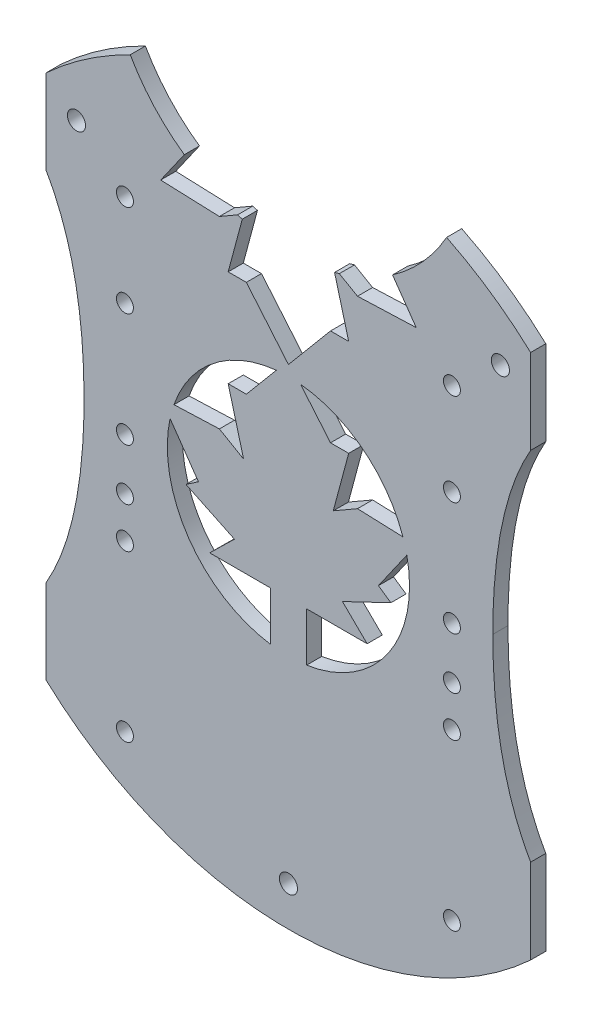
from build123d import *

# Parameters (mm, degrees)
SKETCH1_R           = 1.89865
BOSS_EXTRUDE3_DEPTH = 3.175
CUT_EXTRUDE2_DEPTH  = 3.175
SKETCH4_R           = 1.778
CUT_EXTRUDE3_DEPTH  = 3.175
SKETCH5_R           = 1.778
CUT_EXTRUDE4_DEPTH  = 3.175
CUT_EXTRUDE5_DEPTH  = 3.175
CUT_EXTRUDE6_DEPTH  = 3.175


with BuildPart() as part:
    # Sketch1 → Boss-Extrude3 (new body)
    with BuildSketch(Plane.XY):
        with BuildLine():
            Line((-50.8, 55.175719298), (-50.8, -55.175719298))
            ThreePointArc((-50.8, -55.175719298), (0, -75), (50.8, -55.175719298))
            Line((50.8, -55.175719298), (50.8, 55.175719298))
            ThreePointArc((50.8, 55.175719298), (42.419210034, 61.851520758), (33.172661219, 67.264957799))
            ThreePointArc((33.172661219, 67.264957799), (0, 47.904876359), (-33.172661219, 67.264957799))
            ThreePointArc((-33.172661219, 67.264957799), (-42.419210034, 61.851520758), (-50.8, 55.175719298))
        make_face()
        with Locations((0, -66.675)):
            Circle(SKETCH1_R, mode=Mode.SUBTRACT)
        with Locations((-44.45, 49.6966108)):
            Circle(SKETCH1_R, mode=Mode.SUBTRACT)
        with Locations(Location((44.45, 49.6966108, 0), (0, 0, 180))):
            Circle(SKETCH1_R, mode=Mode.SUBTRACT)
    extrude(amount=BOSS_EXTRUDE3_DEPTH)

    # Sketch3 → Cut-Extrude2 (cut)
    with BuildSketch(Plane.XY.offset(3.175)):
        with BuildLine():
            Line((8.827105782, 17.78), (2.54, 25.272680903))
            ThreePointArc((2.54, 25.272680903), (15.758317518, 19.920728626), (24.009298775, 8.289365013))
            Line((24.009298775, 8.289365013), (14.484298775, 8.647939367))
            Line((14.484298775, 8.647939367), (9.404298775, 5.715))
            Line((9.404298775, 5.715), (12.637105782, 17.78))
            Line((12.637105782, 17.78), (8.827105782, 17.78))
        make_face()
        with BuildLine():
            Line((18.868143133, -3.140634987), (24.826209076, 5.368365013))
            ThreePointArc((24.826209076, 5.368365013), (20.911260009, -14.418016674), (3.81, -25.112624315))
            Line((3.81, -25.112624315), (3.81, -14.877877919))
            Line((3.81, -14.877877919), (16.51, -14.877877919))
            Line((16.51, -14.877877919), (11.327081569, -9.797877919))
            Line((11.327081569, -9.797877919), (21.487081569, -4.935568543))
            Line((21.487081569, -4.935568543), (18.868143133, -3.140634987))
        make_face()
        with BuildLine():
            Line((-3.81, -14.877877919), (-3.81, -25.112624315))
            ThreePointArc((-3.81, -25.112624315), (-20.911260009, -14.418016674), (-24.826209076, 5.368365013))
            Line((-24.826209076, 5.368365013), (-18.868143133, -3.140634987))
            Line((-18.868143133, -3.140634987), (-21.487081569, -4.935568543))
            Line((-21.487081569, -4.935568543), (-11.327081569, -9.797877919))
            Line((-11.327081569, -9.797877919), (-16.51, -14.877877919))
            Line((-16.51, -14.877877919), (-3.81, -14.877877919))
        make_face()
        with BuildLine():
            Line((-14.484298775, 8.647939367), (-24.009298775, 8.289365013))
            ThreePointArc((-24.009298775, 8.289365013), (-15.758317518, 19.920728626), (-2.54, 25.272680903))
            Line((-2.54, 25.272680903), (-8.827105782, 17.78))
            Line((-8.827105782, 17.78), (-12.637105782, 17.78))
            Line((-12.637105782, 17.78), (-9.404298775, 5.715))
            Line((-9.404298775, 5.715), (-14.484298775, 8.647939367))
        make_face()
    extrude(amount=-CUT_EXTRUDE2_DEPTH, mode=Mode.SUBTRACT)

    # Sketch4 → Cut-Extrude3 (cut)
    with BuildSketch(Plane.XY.offset(3.175)):
        with Locations((-34.29, 40.919876359)):
            Circle(SKETCH4_R)
        with Locations((34.29, 40.919876359)):
            Circle(SKETCH4_R)
        with Locations((34.29, -2.260123641)):
            Circle(SKETCH4_R)
        with Locations((-34.29, -2.260123641)):
            Circle(SKETCH4_R)
        with Locations((-34.29, -13.055123641)):
            Circle(SKETCH4_R)
        with Locations((34.29, -13.055123641)):
            Circle(SKETCH4_R)
        with Locations((34.29, -56.235123641)):
            Circle(SKETCH4_R)
        with Locations((-34.29, -56.235123641)):
            Circle(SKETCH4_R)
    extrude(amount=-CUT_EXTRUDE3_DEPTH, mode=Mode.SUBTRACT)

    # Sketch5 → Cut-Extrude4 (cut)
    with BuildSketch(Plane.XY.offset(3.175)):
        with Locations((-34.29, 21.59)):
            Circle(SKETCH5_R)
        with Locations((34.29, 21.59)):
            Circle(SKETCH5_R)
        with Locations((34.29, -21.59)):
            Circle(SKETCH5_R)
        with Locations((-34.29, -21.59)):
            Circle(SKETCH5_R)
    extrude(amount=-CUT_EXTRUDE4_DEPTH, mode=Mode.SUBTRACT)

    # Sketch6 → Cut-Extrude5 (cut)
    with BuildSketch(Plane.XY.offset(3.175)):
        Polygon((-8.827105782, 38.1), (-2.54, 30.607319097), (0, 27.580264972), (2.54, 30.607319097), (8.827105782, 38.1), (12.637105782, 38.1), (9.404298775, 50.165), (14.484298775, 47.232060633), (24.009298775, 47.590634987), (26.798005722, 47.695617537), (24.826209076, 50.511634987), (18.868143133, 59.020634987), (-18.868143133, 59.020634987), (-24.826209076, 50.511634987), (-26.798005722, 47.695617537), (-24.009298775, 47.590634987), (-14.484298775, 47.232060633), (-9.404298775, 50.165), (-12.637105782, 38.1), align=None)
    extrude(amount=-CUT_EXTRUDE5_DEPTH, mode=Mode.SUBTRACT)

    # Sketch7 → Cut-Extrude6 (cut)
    with BuildSketch(Plane.XY.offset(3.175)):
        with BuildLine():
            Line((-50.8, 37.395719298), (-50.8, -37.395719298))
            add(Edge.make_bspline(
                [(-50.8, -37.395719298), (-42.8625, -23.647566012), (-42.8625, 0)],
                knots=[0, 0, 0, 1, 1, 1], degree=2))
            add(Edge.make_bspline(
                [(-50.8, 37.395719298), (-42.8625, 23.647566012), (-42.8625, 0)],
                knots=[0, 0, 0, 1, 1, 1], degree=2))
        make_face()
        with BuildLine():
            Line((50.8, 37.395719298), (50.8, -37.395719298))
            add(Edge.make_bspline(
                [(50.8, -37.395719298), (42.8625, -23.647566012), (42.8625, 0)],
                knots=[0, 0, 0, 1, 1, 1], degree=2))
            add(Edge.make_bspline(
                [(50.8, 37.395719298), (42.8625, 23.647566012), (42.8625, 0)],
                knots=[0, 0, 0, 1, 1, 1], degree=2))
        make_face()
    extrude(amount=-CUT_EXTRUDE6_DEPTH, mode=Mode.SUBTRACT)


solid = part.part
